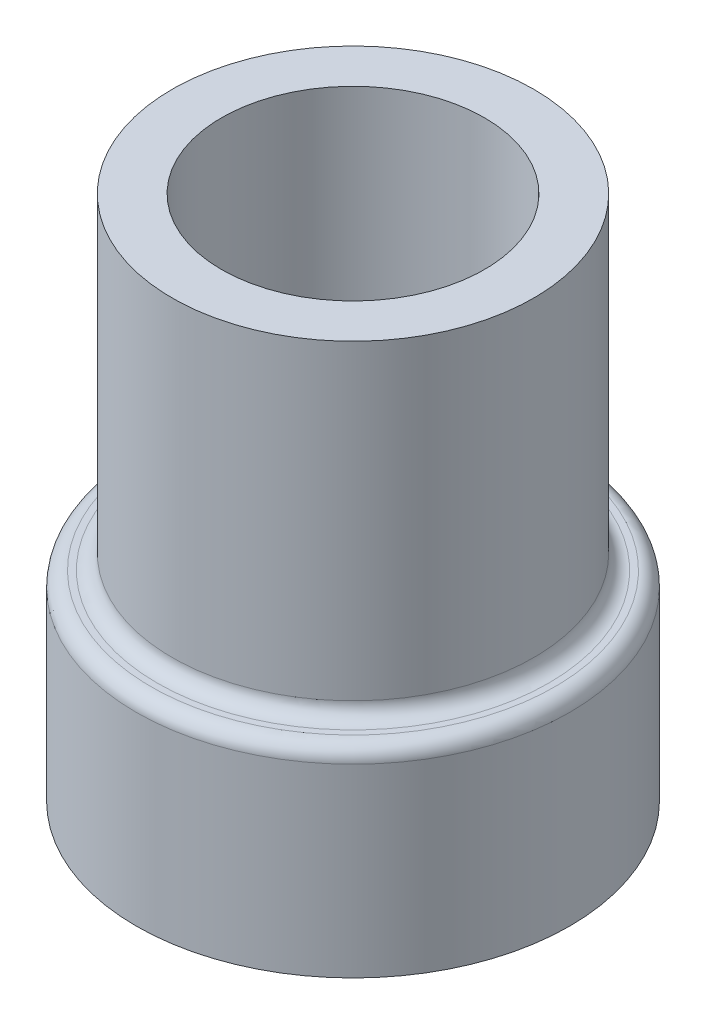
from build123d import *


with BuildPart() as part:
    # Sketch1 → Revolve1 (revolve)
    with BuildSketch(Plane.XY, mode=Mode.PRIVATE) as revolve1_sk:
        with BuildLine():
            Line((0, 20.2692), (-13.335, 20.2692))
            Line((-13.335, 20.2692), (-13.335, 53.34))
            Line((-13.335, 53.34), (-18.335, 53.34))
            Line((-18.335, 53.34), (-18.335, 21.7692))
            ThreePointArc((-18.335, 21.7692), (-18.774339828, 20.708539828), (-19.835, 20.2692))
            Line((-19.835, 20.2692), (-20.471, 20.2692))
            ThreePointArc((-20.471, 20.2692), (-21.531660172, 19.829860172), (-21.971, 18.7692))
            Line((-21.971, 18.7692), (-21.971, 0))
            Line((-21.971, 0), (0, 0))
            Line((0, 0), (0, 20.2692))
        make_face()
    revolve(revolve1_sk.sketch.rotate(Axis((0, 0, 0), (0, 1, 0)), 270), axis=Axis((0, 0, 0), (0, 1, 0)))


solid = part.part
